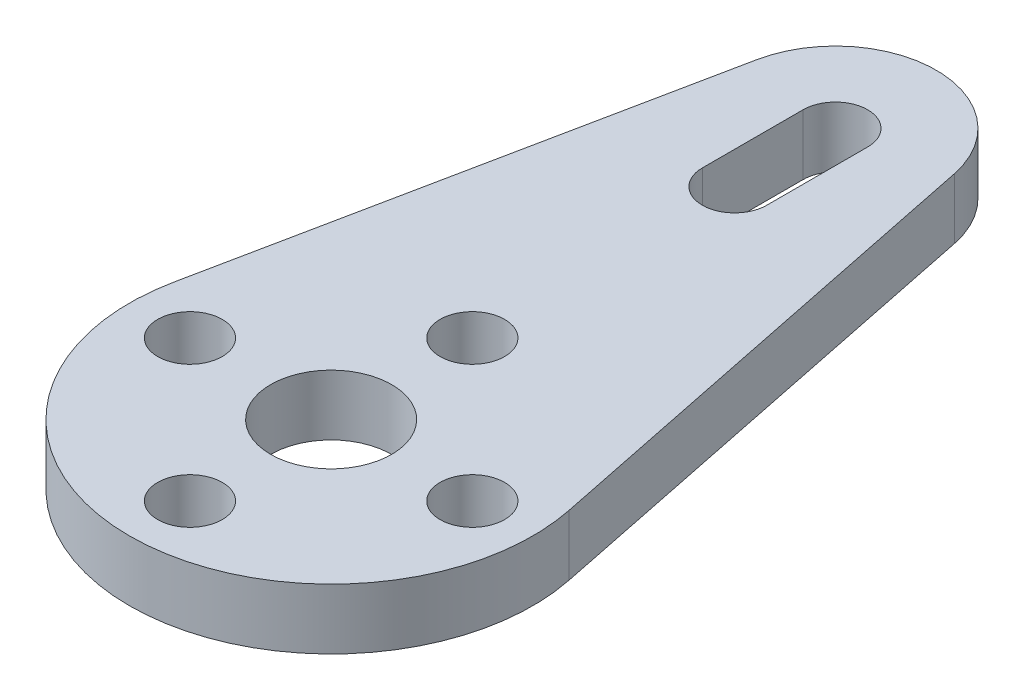
from build123d import *

# Parameters (mm, degrees)
SKETCH1_R           = 3
SKETCH1_R_2         = 1.6
BOSS_EXTRUDE1_DEPTH = 3


with BuildPart() as part:
    # Sketch1 → Boss-Extrude1 (new body)
    with BuildSketch(Plane(origin=(0, 0, 0), x_dir=(1, 0, 0), z_dir=(0, 1, 0))):
        with BuildLine():
            Line((-4.898979486, 26), (-9.797958971, 2))
            ThreePointArc((-9.797958971, 2), (0, -10), (9.797958971, 2))
            Line((9.797958971, 2), (4.898979486, 26))
            ThreePointArc((4.898979486, 26), (0, 30), (-4.898979486, 26))
        make_face()
        with Locations(Location((0, 0, 0), (0, 0, 270))):
            Circle(SKETCH1_R, mode=Mode.SUBTRACT)
        with Locations(Location((0, 7, 0), (0, 0, 270))):
            Circle(SKETCH1_R_2, mode=Mode.SUBTRACT)
        with Locations(Location((7, 0, 0), (0, 0, 270))):
            Circle(SKETCH1_R_2, mode=Mode.SUBTRACT)
        with Locations(Location((0, -7, 0), (0, 0, 270))):
            Circle(SKETCH1_R_2, mode=Mode.SUBTRACT)
        with Locations(Location((-7, 0, 0), (0, 0, 270))):
            Circle(SKETCH1_R_2, mode=Mode.SUBTRACT)
        with BuildLine():
            Line((1.6, 25), (1.6, 20))
            ThreePointArc((1.6, 20), (0, 18.4), (-1.6, 20))
            Line((-1.6, 20), (-1.6, 25))
            ThreePointArc((-1.6, 25), (0, 26.6), (1.6, 25))
        make_face(mode=Mode.SUBTRACT)
    extrude(amount=BOSS_EXTRUDE1_DEPTH)


solid = part.part
